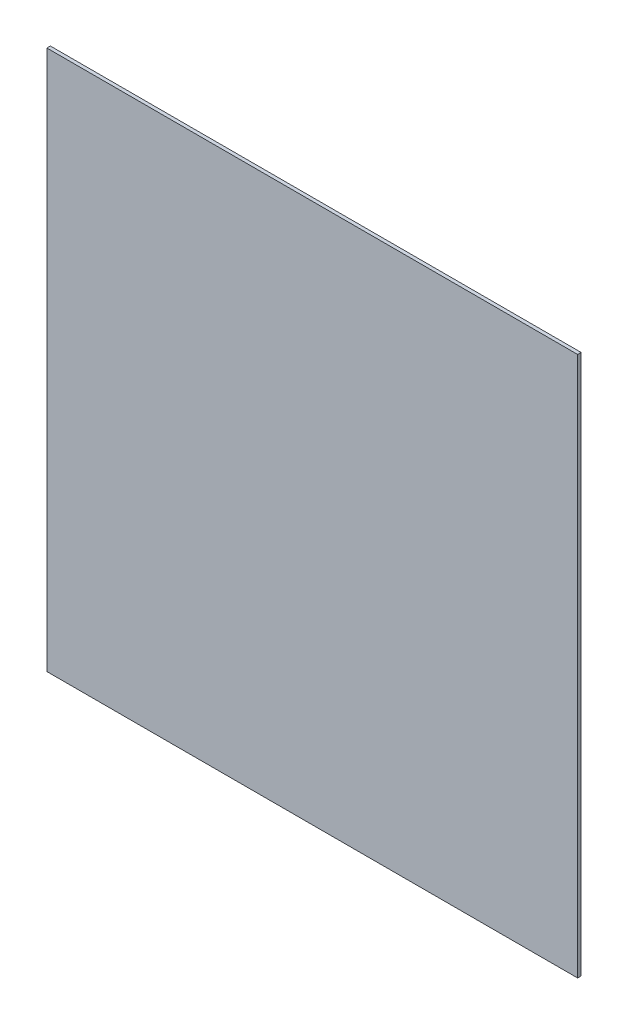
from build123d import *

# Parameters (mm, degrees)
SZKIC1_W                    = 456
SZKIC1_H                    = 464
DODANIE_WYCI_GNI_CIE1_DEPTH = 3


with BuildPart() as part:
    # Szkic1 → Dodanie-wyciągnięcie1 (new body)
    with BuildSketch(Plane.XY):
        with Locations((228, 232)):
            Rectangle(SZKIC1_W, SZKIC1_H)
    extrude(amount=DODANIE_WYCI_GNI_CIE1_DEPTH)


solid = part.part
